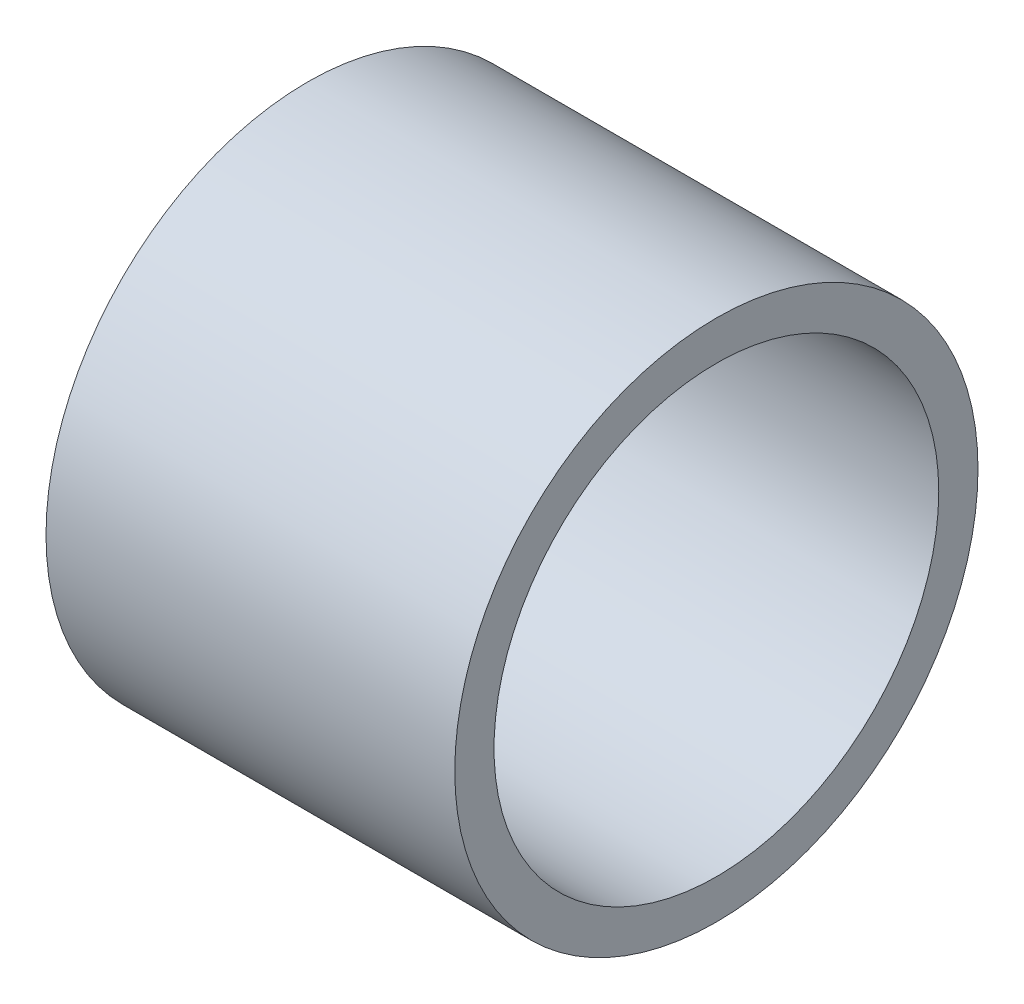
from build123d import *

# Parameters (mm, degrees)
SKETCH1_R           = 16
SKETCH1_R_2         = 13.6
BOSS_EXTRUDE1_DEPTH = 25


with BuildPart() as part:
    # Sketch1 → Boss-Extrude1 (new body)
    with BuildSketch(Plane(origin=(0, 0, 0), x_dir=(0, 0, -1), z_dir=(1, 0, 0))):
        Circle(SKETCH1_R)
        Circle(SKETCH1_R_2, mode=Mode.SUBTRACT)
    extrude(amount=BOSS_EXTRUDE1_DEPTH)


solid = part.part
